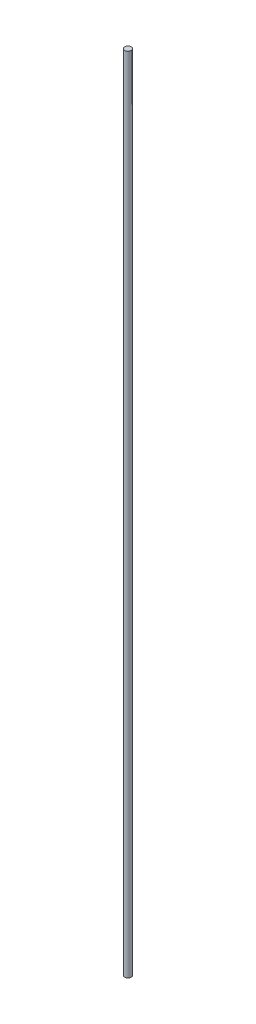
from build123d import *

# Parameters (mm, degrees)
SKETCH1_R           = 3.175
BOSS_EXTRUDE1_DEPTH = 787.4


with BuildPart() as part:
    # Sketch1 → Boss-Extrude1 (new body)
    with BuildSketch(Plane(origin=(0, 0, 0), x_dir=(1, 0, 0), z_dir=(0, 1, 0))):
        with Locations(Location((0, 0, 0), (0, 0, 270))):
            Circle(SKETCH1_R)
    extrude(amount=BOSS_EXTRUDE1_DEPTH)


solid = part.part
